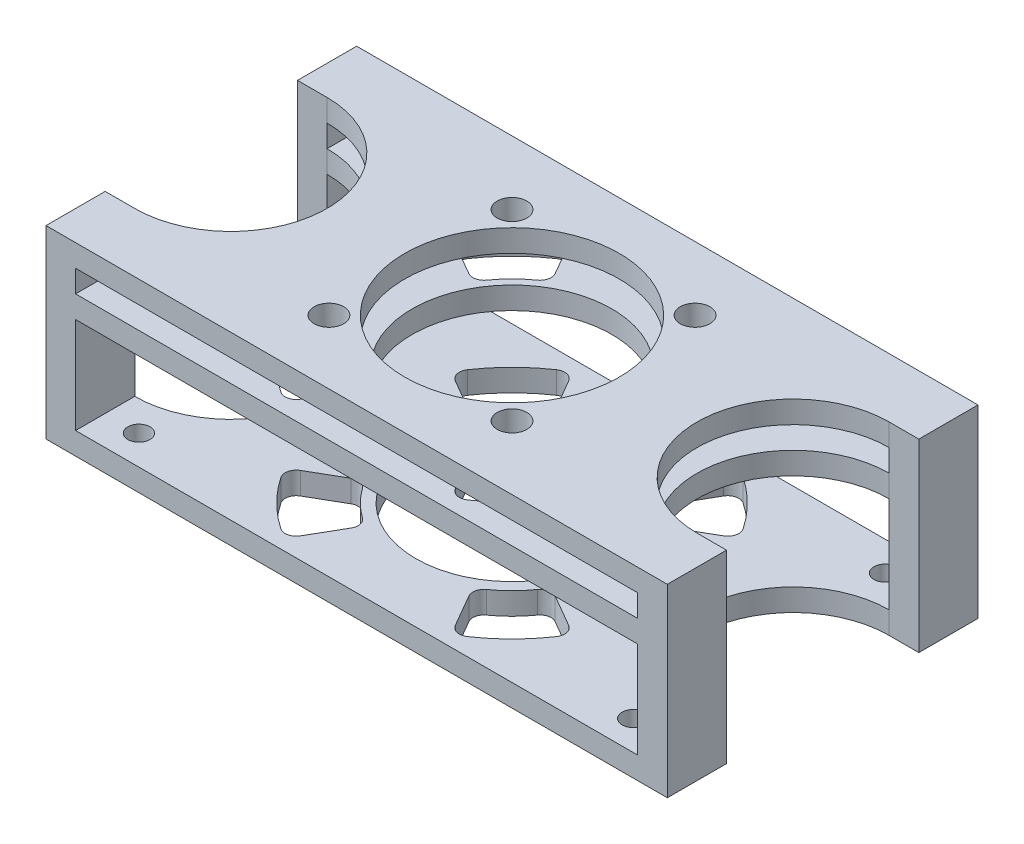
from build123d import *

# Parameters (mm, degrees)
SKETCH_1_W          = 84
SKETCH_1_H          = 42
EXTRUDE_1_DEPTH     = 3
SKETCH_2_W          = 4
SKETCH_2_H          = 42
EXTRUDE_2_DEPTH     = 19
SKETCH_3_W          = 84
SKETCH_3_H          = 42
EXTRUDE_3_DEPTH     = 3
SKETCH_5_W          = 76
SKETCH_5_H          = 3
EXTRUDE_4_DEPTH     = 42
CUT_EXTRUDE_1_REACH = 55.198
SKETCH_4_R          = 14.5
SKETCH_4_R_2        = 2
SKETCH_6_R          = 13.5
CUT_EXTRUDE_2_DEPTH = 3
SKETCH_7_R          = 13
CUT_EXTRUDE_3_DEPTH = 3
CUT_EXTRUDE_4_DEPTH = 54.197744313
SKETCH_9_R          = 1.5
CUT_EXTRUDE_5_DEPTH = 3
CUT_EXTRUDE_START   = -19
CUT_EXTRUDE_6_DEPTH = 19
FILLET_1_R          = 1.5


with BuildPart() as part:
    # 草图1 → 凸台-拉伸1 (new body)
    with BuildSketch(Plane(origin=(0, 0, 0), x_dir=(1, 0, 0), z_dir=(0, 1, 0))):
        Rectangle(SKETCH_1_W, SKETCH_1_H)
    extrude(amount=EXTRUDE_1_DEPTH)

    # 草图2 → 凸台-拉伸2 (add)
    with BuildSketch(Plane(origin=(0, 3, 0), x_dir=(1, 0, 0), z_dir=(0, 1, 0))):
        with Locations((-40, 0)):
            Rectangle(SKETCH_2_W, SKETCH_2_H)
        with Locations((40, 0)):
            Rectangle(SKETCH_2_W, SKETCH_2_H)
    extrude(amount=EXTRUDE_2_DEPTH)

    # 草图3 → 凸台-拉伸3 (add)
    with BuildSketch(Plane(origin=(0, 22, 0), x_dir=(1, 0, 0), z_dir=(0, 1, 0))):
        Rectangle(SKETCH_3_W, SKETCH_3_H)
    extrude(amount=EXTRUDE_3_DEPTH)

    # 草图5 → 凸台-拉伸4 (add)
    with BuildSketch(Plane.XY.offset(21)):
        with Locations((0, 17.5)):
            Rectangle(SKETCH_5_W, SKETCH_5_H)
    extrude(amount=-EXTRUDE_4_DEPTH)

    # 草图4 → 切除-拉伸1 (cut, up to next)
    with BuildSketch(Plane(origin=(0, 25, 0), x_dir=(1, 0, 0), z_dir=(0, 1, 0)), mode=Mode.PRIVATE) as cut_extrude_1_sk1:
        with Locations(Location((0, 0, 0), (0, 0, 270))):
            Circle(SKETCH_4_R)
    cut_extrude_1_tool1 = extrude(cut_extrude_1_sk1.sketch, amount=-CUT_EXTRUDE_1_REACH, mode=Mode.PRIVATE) & part.part
    # 草图4 → 切除-拉伸1 (cut, up to next)
    with BuildSketch(Plane(origin=(0, 25, 0), x_dir=(1, 0, 0), z_dir=(0, 1, 0)), mode=Mode.PRIVATE) as cut_extrude_1_sk2:
        with Locations(Location((12.374368671, 12.374368671, 0), (0, 0, 270))):
            Circle(SKETCH_4_R_2)
    cut_extrude_1_tool2 = extrude(cut_extrude_1_sk2.sketch, amount=-CUT_EXTRUDE_1_REACH, mode=Mode.PRIVATE) & part.part
    # 草图4 → 切除-拉伸1 (cut, up to next)
    with BuildSketch(Plane(origin=(0, 25, 0), x_dir=(1, 0, 0), z_dir=(0, 1, 0)), mode=Mode.PRIVATE) as cut_extrude_1_sk3:
        with Locations(Location((12.374368671, -12.374368671, 0), (0, 0, 270))):
            Circle(SKETCH_4_R_2)
    cut_extrude_1_tool3 = extrude(cut_extrude_1_sk3.sketch, amount=-CUT_EXTRUDE_1_REACH, mode=Mode.PRIVATE) & part.part
    # 草图4 → 切除-拉伸1 (cut, up to next)
    with BuildSketch(Plane(origin=(0, 25, 0), x_dir=(1, 0, 0), z_dir=(0, 1, 0)), mode=Mode.PRIVATE) as cut_extrude_1_sk4:
        with Locations(Location((-12.374368671, -12.374368671, 0), (0, 0, 270))):
            Circle(SKETCH_4_R_2)
    cut_extrude_1_tool4 = extrude(cut_extrude_1_sk4.sketch, amount=-CUT_EXTRUDE_1_REACH, mode=Mode.PRIVATE) & part.part
    # 草图4 → 切除-拉伸1 (cut, up to next)
    with BuildSketch(Plane(origin=(0, 25, 0), x_dir=(1, 0, 0), z_dir=(0, 1, 0)), mode=Mode.PRIVATE) as cut_extrude_1_sk5:
        with Locations(Location((-12.374368671, 12.374368671, 0), (0, 0, 270))):
            Circle(SKETCH_4_R_2)
    cut_extrude_1_tool5 = extrude(cut_extrude_1_sk5.sketch, amount=-CUT_EXTRUDE_1_REACH, mode=Mode.PRIVATE) & part.part
    add(cut_extrude_1_tool1.solids().sort_by_distance((0, 25, 0))[0], mode=Mode.SUBTRACT)
    add(cut_extrude_1_tool2.solids().sort_by_distance((12.374369, 25, -12.374369))[0], mode=Mode.SUBTRACT)
    add(cut_extrude_1_tool3.solids().sort_by_distance((12.374369, 25, 12.374369))[0], mode=Mode.SUBTRACT)
    add(cut_extrude_1_tool4.solids().sort_by_distance((-12.374369, 25, 12.374369))[0], mode=Mode.SUBTRACT)
    add(cut_extrude_1_tool5.solids().sort_by_distance((-12.374369, 25, -12.374369))[0], mode=Mode.SUBTRACT)

    # 草图6 → 切除-拉伸2 (cut)
    with BuildSketch(Plane(origin=(0, 19, 0), x_dir=(1, 0, 0), z_dir=(0, 1, 0))):
        with Locations(Location((0, 0, 0), (0, 0, 270))):
            Circle(SKETCH_6_R)
    extrude(amount=-CUT_EXTRUDE_2_DEPTH, mode=Mode.SUBTRACT)

    # 草图7 → 切除-拉伸3 (cut)
    with BuildSketch(Plane.XZ):
        with Locations(Location((0, 0, 0), (0, 0, 270))):
            Circle(SKETCH_7_R)
    extrude(amount=-CUT_EXTRUDE_3_DEPTH, mode=Mode.SUBTRACT)

    # 草图8 → 切除-拉伸4 (cut, through all)
    with BuildSketch(Plane(origin=(0, 25, 0), x_dir=(1, 0, 0), z_dir=(0, 1, 0))):
        with BuildLine():
            Line((42, -13), (38, -13))
            ThreePointArc((38, -13), (25, 0), (38, 13))
            Line((38, 13), (42, 13))
            Line((42, 13), (42, -13))
        make_face()
        with BuildLine():
            Line((-42, 13), (-38, 13))
            ThreePointArc((-38, 13), (-25, 0), (-38, -13))
            Line((-38, -13), (-42, -13))
            Line((-42, -13), (-42, 13))
        make_face()
    extrude(amount=-CUT_EXTRUDE_4_DEPTH, mode=Mode.SUBTRACT)

    # 草图9 → 切除-拉伸5 (cut)
    with BuildSketch(Plane.XZ):
        with Locations(Location((33.412744657, 17.02464374, 0), (0, 0, 270))):
            Circle(SKETCH_9_R)
        with Locations(Location((-33.412744657, 17.02464374, 0), (0, 0, 90))):
            Circle(SKETCH_9_R)
        with Locations(Location((33.412744657, -17.02464374, 0), (0, 0, 90))):
            Circle(SKETCH_9_R)
        with Locations(Location((-33.412744657, -17.02464374, 0), (0, 0, 270))):
            Circle(SKETCH_9_R)
    extrude(amount=-CUT_EXTRUDE_5_DEPTH, mode=Mode.SUBTRACT)

    # 草图10 → 切除-拉伸6 (cut)
    with BuildSketch(Plane.XZ.offset(CUT_EXTRUDE_START)):
        with BuildLine():
            Line((7.25, 12.557368355), (11.25, 19.485571585))
            ThreePointArc((11.25, 19.485571585), (15.909902577, 15.909902577), (19.485571585, 11.25))
            Line((19.485571585, 11.25), (12.557368355, 7.25))
            ThreePointArc((12.557368355, 7.25), (10.253048327, 10.253048327), (7.25, 12.557368355))
        make_face()
        with BuildLine():
            Line((12.557368355, -7.25), (19.485571585, -11.25))
            ThreePointArc((19.485571585, -11.25), (15.909902577, -15.909902577), (11.25, -19.485571585))
            Line((11.25, -19.485571585), (7.25, -12.557368355))
            ThreePointArc((7.25, -12.557368355), (10.253048327, -10.253048327), (12.557368355, -7.25))
        make_face()
        with BuildLine():
            Line((-7.25, -12.557368355), (-11.25, -19.485571585))
            ThreePointArc((-11.25, -19.485571585), (-15.909902577, -15.909902577), (-19.485571585, -11.25))
            Line((-19.485571585, -11.25), (-12.557368355, -7.25))
            ThreePointArc((-12.557368355, -7.25), (-10.253048327, -10.253048327), (-7.25, -12.557368355))
        make_face()
        with BuildLine():
            Line((-12.557368355, 7.25), (-19.485571585, 11.25))
            ThreePointArc((-19.485571585, 11.25), (-15.909902577, 15.909902577), (-11.25, 19.485571585))
            Line((-11.25, 19.485571585), (-7.25, 12.557368355))
            ThreePointArc((-7.25, 12.557368355), (-10.253048327, 10.253048327), (-12.557368355, 7.25))
        make_face()
    extrude(amount=CUT_EXTRUDE_6_DEPTH, mode=Mode.SUBTRACT)

    # 圆角1
    fillet_1_edges = [part.edges().sort_by_distance(p)[0] for p in [
        (-11.25, 1.5, 19.485571585),
        (-19.485571585, 1.5, 11.25),
        (-12.557368355, 1.5, 7.25),
        (-7.25, 1.5, 12.557368355),
        (-11.25, 17.5, 19.485571585),
        (-19.485571585, 17.5, 11.25),
        (-12.557368355, 17.5, 7.25),
        (-7.25, 17.5, 12.557368355),
        (-19.485571585, 1.5, -11.25),
        (-11.25, 1.5, -19.485571585),
        (-7.25, 1.5, -12.557368355),
        (-12.557368355, 1.5, -7.25),
        (-19.485571585, 17.5, -11.25),
        (-11.25, 17.5, -19.485571585),
        (-7.25, 17.5, -12.557368355),
        (-12.557368355, 17.5, -7.25),
        (11.25, 1.5, -19.485571585),
        (19.485571585, 1.5, -11.25),
        (12.557368355, 1.5, -7.25),
        (7.25, 1.5, -12.557368355),
        (11.25, 17.5, -19.485571585),
        (19.485571585, 17.5, -11.25),
        (12.557368355, 17.5, -7.25),
        (7.25, 17.5, -12.557368355),
        (19.485571585, 1.5, 11.25),
        (11.25, 1.5, 19.485571585),
        (7.25, 1.5, 12.557368355),
        (12.557368355, 1.5, 7.25),
        (19.485571585, 17.5, 11.25),
        (11.25, 17.5, 19.485571585),
        (7.25, 17.5, 12.557368355),
        (12.557368355, 17.5, 7.25),
    ]]
    fillet(fillet_1_edges, radius=FILLET_1_R)


solid = part.part
